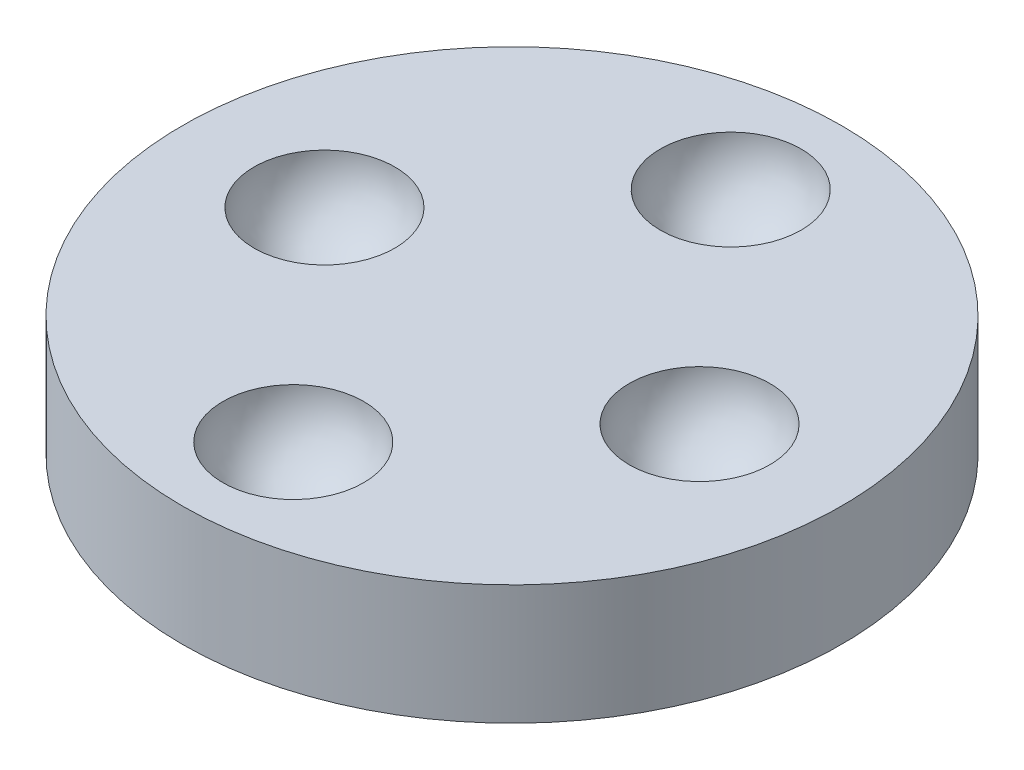
from build123d import *

# Parameters (mm, degrees)
SKETCH1_R           = 13.97
BOSS_EXTRUDE1_DEPTH = 5.08


with BuildPart() as part:
    # Sketch1 → Boss-Extrude1 (new body)
    with BuildSketch(Plane(origin=(0, 0, 0), x_dir=(1, 0, 0), z_dir=(0, 1, 0))):
        with Locations(Location((0, 0, 0), (0, 0, 270))):
            Circle(SKETCH1_R)
    extrude(amount=BOSS_EXTRUDE1_DEPTH)

    # Sketch5 → Cut-Revolve3 (revolve, cut)
    with BuildSketch(Plane(origin=(7.9502, 0, 0), x_dir=(0, 0, -1), z_dir=(1, 0, 0))):
        with BuildLine():
            Line((0, 5.08), (0, 2.0955))
            ThreePointArc((0, 2.0955), (-2.110360188, 2.969639812), (-2.9845, 5.08))
            Line((-2.9845, 5.08), (0, 5.08))
        make_face()
    cut_revolve3 = revolve(axis=Axis((7.9502, 5.08, 0), (0, -1, 0)), mode=Mode.SUBTRACT)

    # Mirror3: Cut-Revolve3 across plane
    add(cut_revolve3.mirror(Plane(origin=(0, 0, 0), x_dir=(0, 0, 1), z_dir=(1, 0, 0))), mode=Mode.SUBTRACT)

    # Sketch3 → Cut-Revolve4 (revolve, cut)
    with BuildSketch(Plane.XY.offset(-9.271)):
        with BuildLine():
            Line((0, 5.08), (0, 2.0955))
            ThreePointArc((0, 2.0955), (2.110360188, 2.969639812), (2.9845, 5.08))
            Line((2.9845, 5.08), (0, 5.08))
        make_face()
    cut_revolve4 = revolve(axis=Axis((0, 5.08, -9.271), (0, -1, 0)), mode=Mode.SUBTRACT)

    # Mirror4: Cut-Revolve4 across plane
    add(cut_revolve4.mirror(Plane.XY), mode=Mode.SUBTRACT)


solid = part.part
